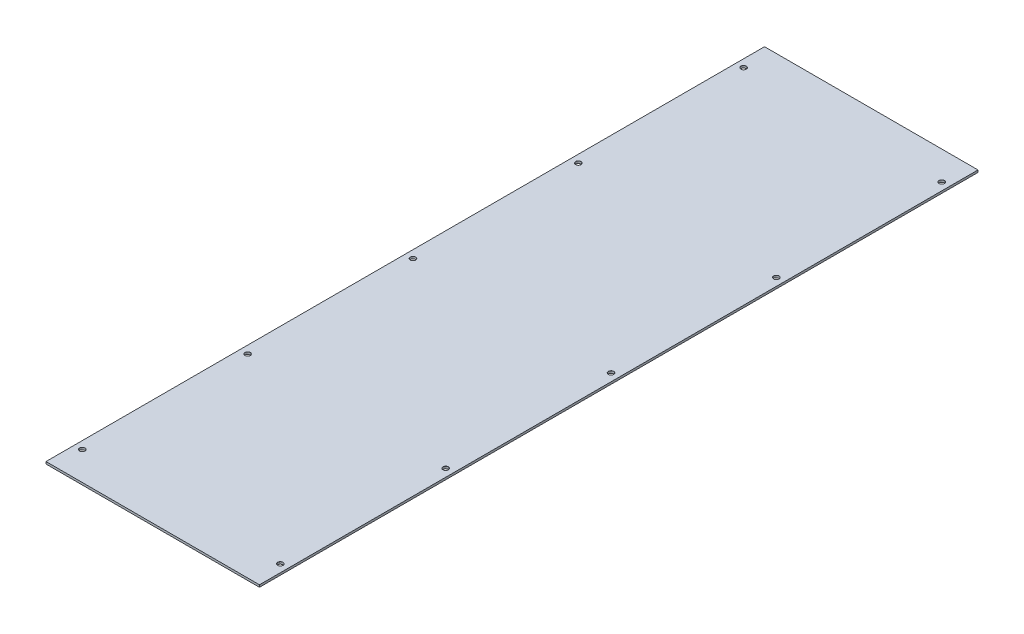
from build123d import *

# Parameters (mm, degrees)
SKETCH1_W                      = 97
SKETCH1_H                      = 1
BOSS_EXTRUDE1_DEPTH            = 326.5
M2_CLEARANCE_HOLE1_AT_2_COUNT  = 2
M2_CLEARANCE_HOLE1_AT_2_PITCH  = 90
M2_CLEARANCE_HOLE1_AT_3_COUNT  = 2
M2_CLEARANCE_HOLE1_AT_3_PITCH  = 75.125
M2_CLEARANCE_HOLE1_AT_4_COUNT  = 2
M2_CLEARANCE_HOLE1_AT_4_PITCH  = 117.233807517
M2_CLEARANCE_HOLE1_AT_5_COUNT  = 2
M2_CLEARANCE_HOLE1_AT_5_PITCH  = 150.25
M2_CLEARANCE_HOLE1_AT_6_COUNT  = 2
M2_CLEARANCE_HOLE1_AT_6_PITCH  = 175.142977307
M2_CLEARANCE_HOLE1_AT_7_COUNT  = 2
M2_CLEARANCE_HOLE1_AT_7_PITCH  = 225.375
M2_CLEARANCE_HOLE1_AT_8_COUNT  = 2
M2_CLEARANCE_HOLE1_AT_8_PITCH  = 242.680635043
M2_CLEARANCE_HOLE1_AT_9_COUNT  = 2
M2_CLEARANCE_HOLE1_AT_9_PITCH  = 300.5
M2_CLEARANCE_HOLE1_AT_10_COUNT = 2
M2_CLEARANCE_HOLE1_AT_10_PITCH = 313.688141312


with BuildPart() as part:
    # Sketch1 → Boss-Extrude1 (new body)
    with BuildSketch(Plane.XY):
        with Locations((48.5, 0.5)):
            Rectangle(SKETCH1_W, SKETCH1_H)
    extrude(amount=BOSS_EXTRUDE1_DEPTH)

    # Sketch3 → M2 Clearance Hole1 (revolve, cut)
    with BuildSketch(Plane(origin=(3.5, 1, 313.5), x_dir=(0, 0, 1), z_dir=(1, 0, 0))):
        Polygon((0, 0), (0, 1), (1.2, 1), (1.2, 0.025), (1.225, 0), align=None)
    m2_clearance_hole1 = revolve(axis=Axis((3.5, 7.35, 313.5), (0, -1, 0)), mode=Mode.SUBTRACT)

    # M2 Clearance Hole1 at 2: M2 Clearance Hole1 ×2
    with Locations(*[(i * M2_CLEARANCE_HOLE1_AT_2_PITCH, 0, 0) for i in range(1, M2_CLEARANCE_HOLE1_AT_2_COUNT)]):
        add(m2_clearance_hole1, mode=Mode.SUBTRACT)

    # M2 Clearance Hole1 at 3: M2 Clearance Hole1 ×2
    with Locations(*[(0, 0, -i * M2_CLEARANCE_HOLE1_AT_3_PITCH) for i in range(1, M2_CLEARANCE_HOLE1_AT_3_COUNT)]):
        add(m2_clearance_hole1, mode=Mode.SUBTRACT)

    # M2 Clearance Hole1 at 4: M2 Clearance Hole1 ×2
    with Locations(*[Vector(0.7676966389301124, 0, -0.6408134444402744) * (i * M2_CLEARANCE_HOLE1_AT_4_PITCH) for i in range(1, M2_CLEARANCE_HOLE1_AT_4_COUNT)]):
        add(m2_clearance_hole1, mode=Mode.SUBTRACT)

    # M2 Clearance Hole1 at 5: M2 Clearance Hole1 ×2
    with Locations(*[(0, 0, -i * M2_CLEARANCE_HOLE1_AT_5_PITCH) for i in range(1, M2_CLEARANCE_HOLE1_AT_5_COUNT)]):
        add(m2_clearance_hole1, mode=Mode.SUBTRACT)

    # M2 Clearance Hole1 at 6: M2 Clearance Hole1 ×2
    with Locations(*[Vector(0.5138658790879463, 0, -0.8578705370329326) * (i * M2_CLEARANCE_HOLE1_AT_6_PITCH) for i in range(1, M2_CLEARANCE_HOLE1_AT_6_COUNT)]):
        add(m2_clearance_hole1, mode=Mode.SUBTRACT)

    # M2 Clearance Hole1 at 7: M2 Clearance Hole1 ×2
    with Locations(*[(0, 0, -i * M2_CLEARANCE_HOLE1_AT_7_PITCH) for i in range(1, M2_CLEARANCE_HOLE1_AT_7_COUNT)]):
        add(m2_clearance_hole1, mode=Mode.SUBTRACT)

    # M2 Clearance Hole1 at 8: M2 Clearance Hole1 ×2
    with Locations(*[Vector(0.3708577735671273, 0, -0.9286896746410146) * (i * M2_CLEARANCE_HOLE1_AT_8_PITCH) for i in range(1, M2_CLEARANCE_HOLE1_AT_8_COUNT)]):
        add(m2_clearance_hole1, mode=Mode.SUBTRACT)

    # M2 Clearance Hole1 at 9: M2 Clearance Hole1 ×2
    with Locations(*[(0, 0, -i * M2_CLEARANCE_HOLE1_AT_9_PITCH) for i in range(1, M2_CLEARANCE_HOLE1_AT_9_COUNT)]):
        add(m2_clearance_hole1, mode=Mode.SUBTRACT)

    # M2 Clearance Hole1 at 10: M2 Clearance Hole1 ×2
    with Locations(*[Vector(0.2869091564108013, 0, -0.9579577944605088) * (i * M2_CLEARANCE_HOLE1_AT_10_PITCH) for i in range(1, M2_CLEARANCE_HOLE1_AT_10_COUNT)]):
        add(m2_clearance_hole1, mode=Mode.SUBTRACT)


solid = part.part
